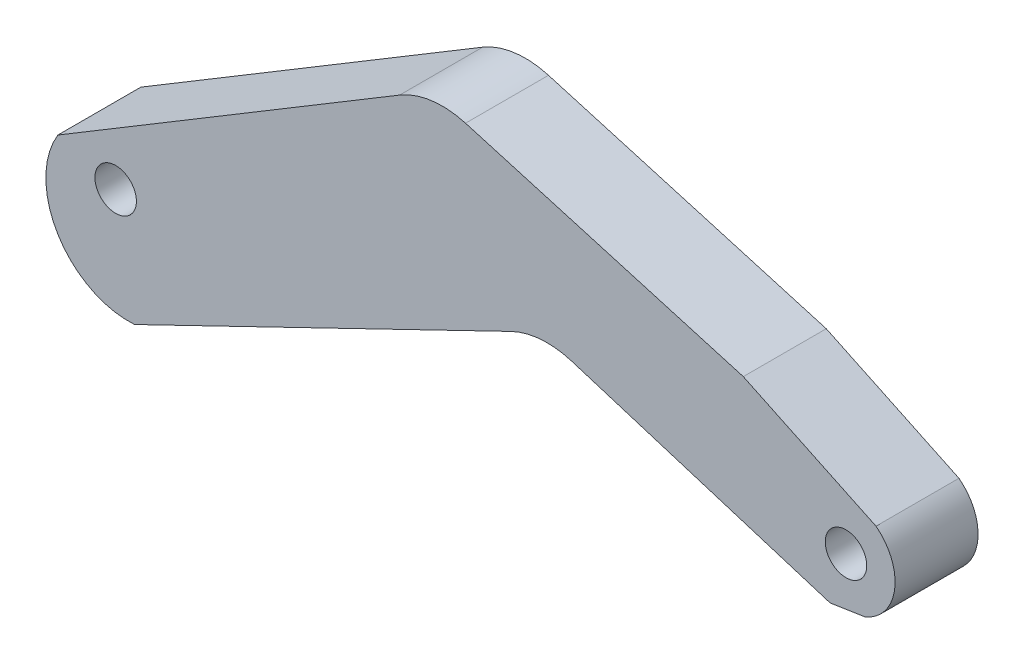
from build123d import *

# Parameters (mm, degrees)
SKETCH1_R           = 1
BOSS_EXTRUDE1_DEPTH = 4


with BuildPart() as part:
    # Sketch1 → Boss-Extrude1 (new body)
    with BuildSketch(Plane.XY):
        with BuildLine():
            ThreePointArc((5.156576759, 1.559717202), (3.671639417, 1.728041702), (2.228559137, 1.33959434))
            Line((2.228559137, 1.33959434), (-15.922809802, -7.447699535))
            ThreePointArc((-15.922809802, -7.447699535), (-19.613741884, -5.538880366), (-19.618658264, -1.383576999))
            Line((-19.618658264, -1.383576999), (-3.138918463, 8.524968964))
            ThreePointArc((-3.138918463, 8.524968964), (-1.594204388, 9.063420424), (0.036885671, 8.938453372))
            Line((0.036885671, 8.938453372), (13.428494888, 5.052778925))
            Line((13.428494888, 5.052778925), (19.826885957, 2.008227813))
            ThreePointArc((19.826885957, 2.008227813), (20.731162158, -0.159872308), (19.323277912, -2.040360419))
            Line((19.323277912, -2.040360419), (17.611370722, -2.303684453))
            Line((17.611370722, -2.303684453), (5.156576759, 1.559717202))
        make_face()
        with Locations((-16.832912189, -2.260702488)):
            Circle(SKETCH1_R, mode=Mode.SUBTRACT)
        with Locations((18.38085461, 0.132484859)):
            Circle(SKETCH1_R, mode=Mode.SUBTRACT)
    extrude(amount=BOSS_EXTRUDE1_DEPTH)


solid = part.part
